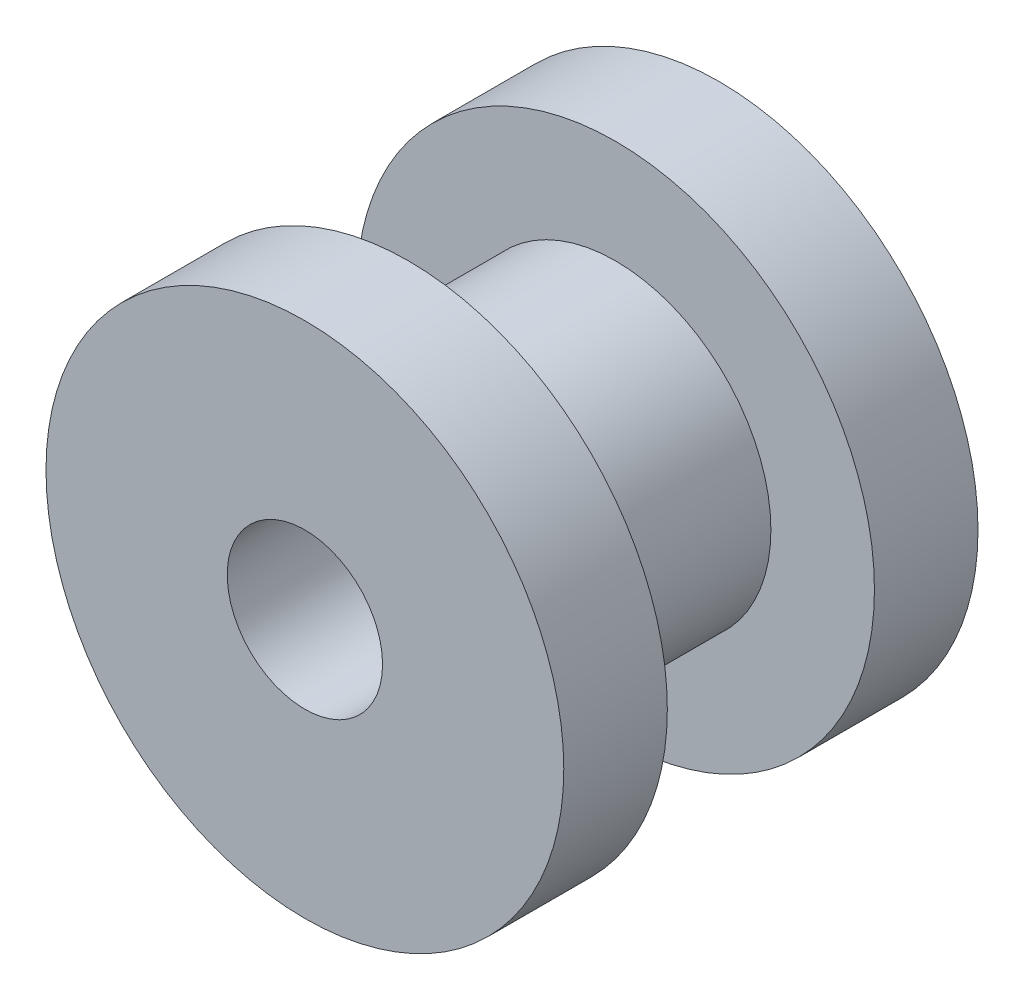
from build123d import *

# Parameters (mm, degrees)
SKETCH1_R           = 1.5
BOSS_EXTRUDE1_DEPTH = 1
SKETCH2_R           = 2.5
BOSS_EXTRUDE2_DEPTH = 1
SKETCH3_R           = 0.75
CUT_EXTRUDE1_DEPTH  = 6.338539126


with BuildPart() as part:
    # Sketch1 → Boss-Extrude1 (new, symmetric)
    with BuildSketch(Plane.XY):
        Circle(SKETCH1_R)
    extrude(amount=BOSS_EXTRUDE1_DEPTH, both=True)

    # Sketch2 → Boss-Extrude2 (add)
    with BuildSketch(Plane.XY.offset(1)):
        Circle(SKETCH2_R)
    boss_extrude2 = extrude(amount=BOSS_EXTRUDE2_DEPTH)

    # Mirror1: Boss-Extrude2 across plane
    add(boss_extrude2.mirror(Plane.XY))

    # Sketch3 → Cut-Extrude1 (cut, through all)
    with BuildSketch(Plane.XY.offset(2)):
        Circle(SKETCH3_R)
    extrude(amount=-CUT_EXTRUDE1_DEPTH, mode=Mode.SUBTRACT)


solid = part.part
